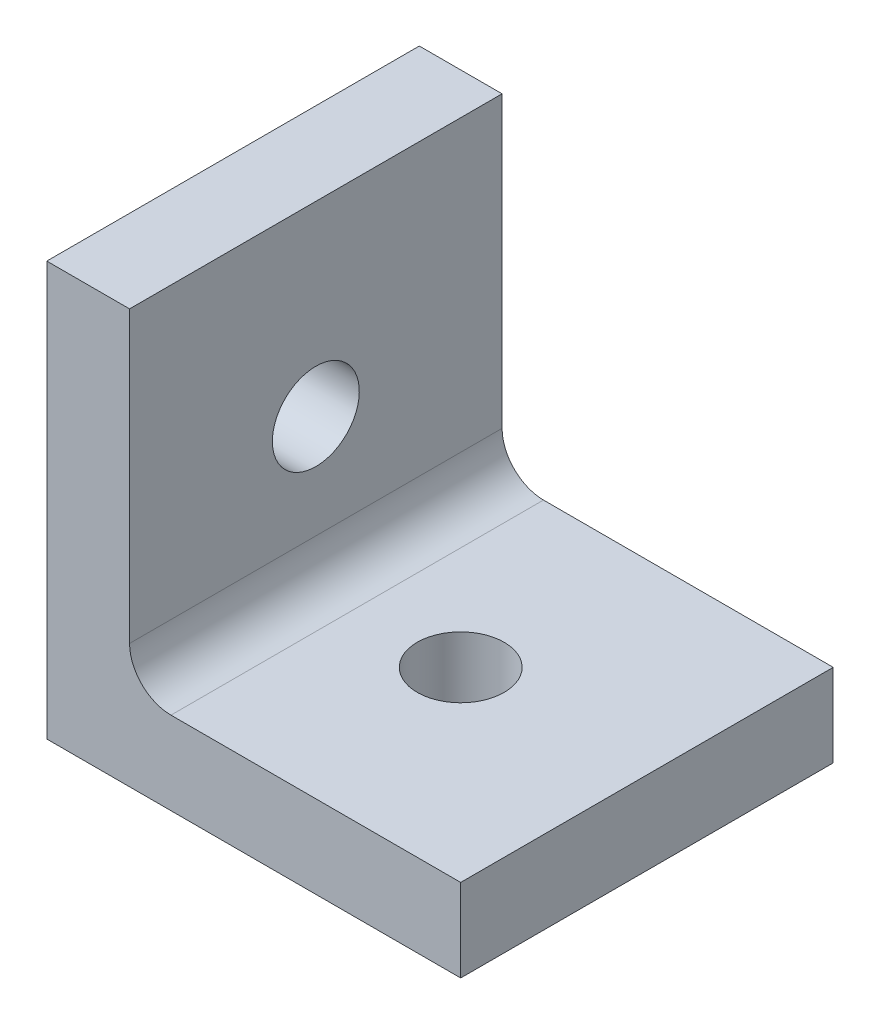
from build123d import *

# Parameters (mm, degrees)
DODANIE_WYCI_GNI_CIE1_DEPTH = 18
SZKIC2_R                    = 2.1
WYTNIJ_WYCI_GNI_CIE1_DEPTH  = 32.304951685
SZKIC3_R                    = 2.1
WYTNIJ_WYCI_GNI_CIE2_DEPTH  = 32.304951685
ZAOKR_GLENIE1_R             = 2


with BuildPart() as part:
    # Szkic1 → Dodanie-wyciągnięcie1 (new body)
    with BuildSketch(Plane.XY):
        Polygon((0, 0), (20, 0), (20, 4), (4, 4), (4, 20), (0, 20), align=None)
    extrude(amount=DODANIE_WYCI_GNI_CIE1_DEPTH)

    # Szkic2 → Wytnij-wyciągnięcie1 (cut, through all)
    with BuildSketch(Plane(origin=(4, 0, 0), x_dir=(0, 0, -1), z_dir=(1, 0, 0))):
        with Locations(Location((-9, 11, 0), (0, 0, 90))):
            Circle(SZKIC2_R)
    extrude(amount=-WYTNIJ_WYCI_GNI_CIE1_DEPTH, mode=Mode.SUBTRACT)

    # Szkic3 → Wytnij-wyciągnięcie2 (cut, through all)
    with BuildSketch(Plane(origin=(0, 4, 0), x_dir=(1, 0, 0), z_dir=(0, 1, 0))):
        with Locations(Location((11, -9, 0), (0, 0, 180))):
            Circle(SZKIC3_R)
    extrude(amount=-WYTNIJ_WYCI_GNI_CIE2_DEPTH, mode=Mode.SUBTRACT)

    # Zaokrąglenie1
    zaokr_glenie1_edges = [part.edges().sort_by_distance(p)[0] for p in [
        (4, 4, 9),
    ]]
    fillet(zaokr_glenie1_edges, radius=ZAOKR_GLENIE1_R)


solid = part.part
